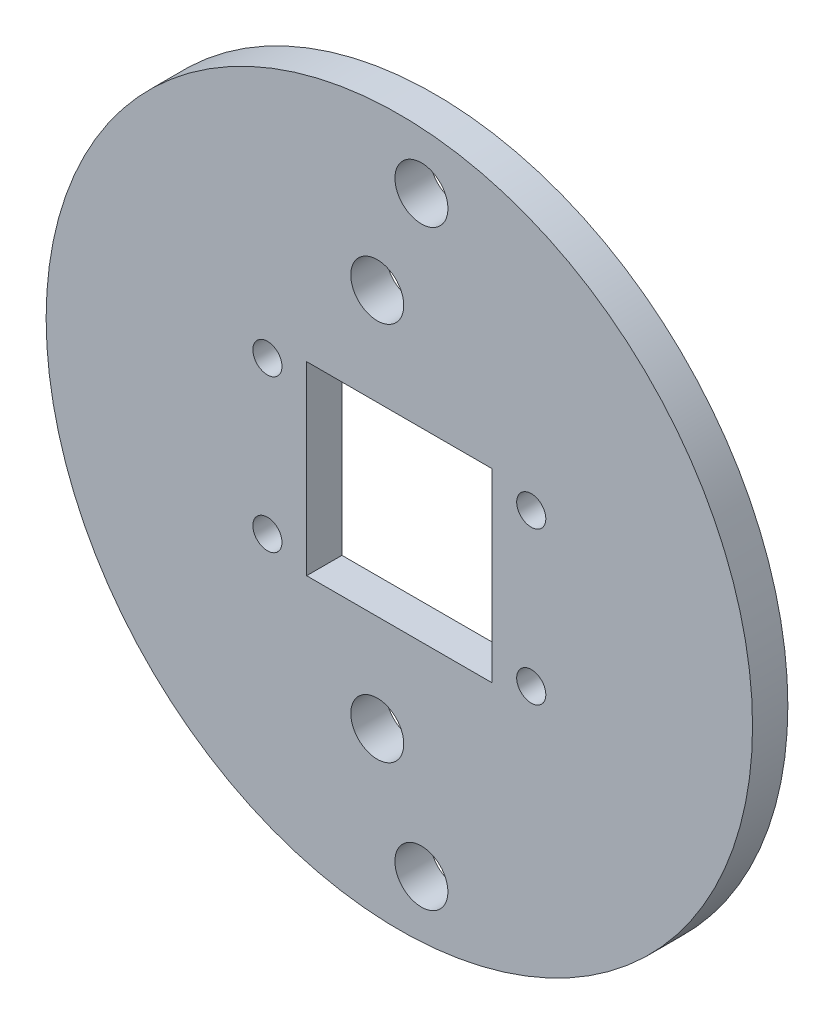
from build123d import *

# Parameters (mm, degrees)
SKETCH_1_R      = 40
SKETCH_1_R_2    = 1.65
SKETCH_1_R_3    = 3
SKETCH_1_W      = 21
SKETCH_1_H      = 21
EXTRUDE_1_DEPTH = 4


with BuildPart() as part:
    # 草图1 → 凸台-拉伸1 (new body)
    with BuildSketch(Plane.XY):
        Circle(SKETCH_1_R)
        with Locations((14.938938215, 8.625)):
            Circle(SKETCH_1_R_2, mode=Mode.SUBTRACT)
        with Locations((14.938938215, -8.625)):
            Circle(SKETCH_1_R_2, mode=Mode.SUBTRACT)
        with Locations((-14.938938215, -8.625)):
            Circle(SKETCH_1_R_2, mode=Mode.SUBTRACT)
        with Locations((-14.938938215, 8.625)):
            Circle(SKETCH_1_R_2, mode=Mode.SUBTRACT)
        with Locations((2.5, 33.5)):
            Circle(SKETCH_1_R_3, mode=Mode.SUBTRACT)
        with Locations((-2.5, 21.5)):
            Circle(SKETCH_1_R_3, mode=Mode.SUBTRACT)
        with Locations(Location((-2.5, -21.5, 0), (0, 0, 180))):
            Circle(SKETCH_1_R_3, mode=Mode.SUBTRACT)
        with Locations(Location((2.5, -33.5, 0), (0, 0, 180))):
            Circle(SKETCH_1_R_3, mode=Mode.SUBTRACT)
        Rectangle(SKETCH_1_W, SKETCH_1_H, mode=Mode.SUBTRACT)
    extrude(amount=EXTRUDE_1_DEPTH)


solid = part.part
